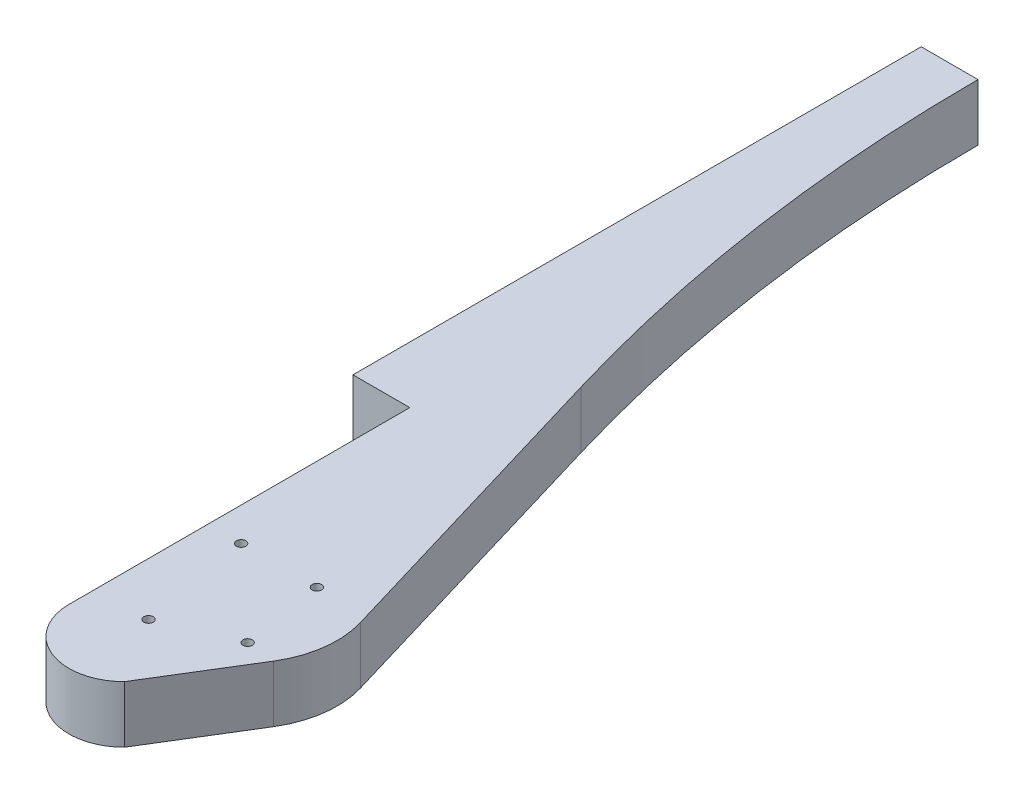
from build123d import *

# Parameters (mm, degrees)
BOSS_EXTRUDE1_DEPTH              = 19.05
F_1_8_0_125_DIAMETER_HOLE1_D     = 3.175
F_1_8_0_125_DIAMETER_HOLE1_DEPTH = 11.1252
F_1_8_0_125_DIAMETER_HOLE1_TIP   = 0.953866233
F_1_8_0_125_DIAMETER_HOLE2_D     = 3.175


with BuildPart() as part:
    # Sketch1 → Boss-Extrude1 (new body)
    with BuildSketch(Plane(origin=(0, 0, 0), x_dir=(1, 0, 0), z_dir=(0, 1, 0))):
        with BuildLine():
            Line((31.75, -13.073529412), (50.765202328, 17.881902266))
            ThreePointArc((50.765202328, 17.881902266), (55.191250928, 30.365130488), (54.139291827, 43.567943639))
            Line((54.139291827, 43.567943639), (22.722603429, 148.989996692))
            ThreePointArc((22.722603429, 148.989996692), (5.710537817, 226.070917322), (0, 304.8))
            Line((0, 304.8), (-19.05, 304.8))
            Line((-19.05, 304.8), (-19.05, 114.3))
            Line((-19.05, 114.3), (0, 114.3))
            Line((0, 114.3), (0, 0))
            ThreePointArc((0, 0), (11.497376237, -17.168136702), (31.75, -13.073529412))
        make_face()
    extrude(amount=BOSS_EXTRUDE1_DEPTH)

    # 1/8 (0.125) Diameter Hole1
    with Locations(Plane(origin=(0, 0, 0), x_dir=(-1, 0, 0), z_dir=(0, -1, 0))):
        with Locations((-3.220551607, 139.7), (-18.566608997, 0), (9.525, 279.4)):
            Hole(F_1_8_0_125_DIAMETER_HOLE1_D / 2, depth=F_1_8_0_125_DIAMETER_HOLE1_DEPTH)
            with Locations((0, 0, -(F_1_8_0_125_DIAMETER_HOLE1_DEPTH + F_1_8_0_125_DIAMETER_HOLE1_TIP / 2))):  # 118° drill point
                Cone(0, F_1_8_0_125_DIAMETER_HOLE1_D / 2, F_1_8_0_125_DIAMETER_HOLE1_TIP, mode=Mode.SUBTRACT)

    # 1/8 (0.125) Diameter Hole2 (through all)
    with Locations(Plane(origin=(0, 19.05, 0), x_dir=(1, 0, 0), z_dir=(0, 1, 0))):
        with Locations((36.578180871, 46.570899758), (11.178180871, 46.576310918), (17.707917982, 9.005992113), (41.037990009, 18.900486467)):
            Hole(F_1_8_0_125_DIAMETER_HOLE2_D / 2)


solid = part.part
